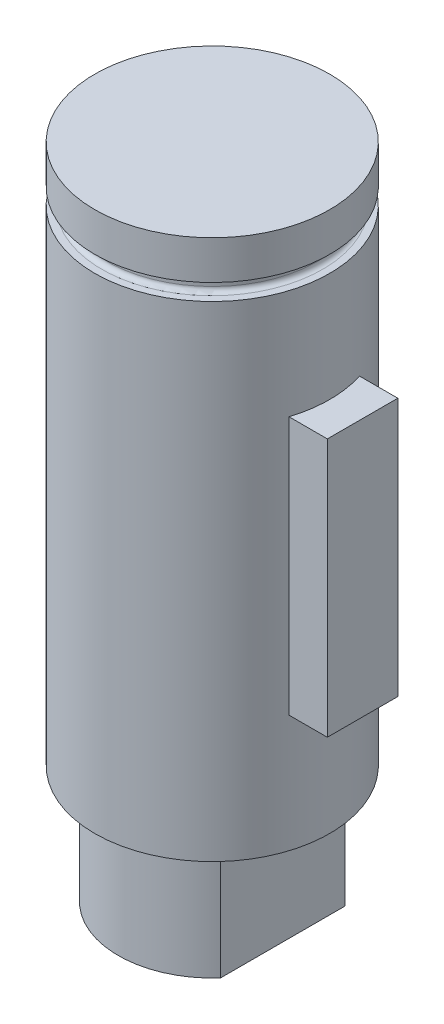
from build123d import *

# Parameters (mm, degrees)
BOSS_EXTRUDE1_DEPTH = 11
SKETCH2_R           = 5
BOSS_EXTRUDE2_DEPTH = 7
BOSS_EXTRUDE3_START = 5
SKETCH3_R           = 5
BOSS_EXTRUDE3_DEPTH = 5
SKETCH4_R           = 1.5
CUT_EXTRUDE1_DEPTH  = 5
BOSS_EXTRUDE4_START = 5
SKETCH5_R           = 1.5
BOSS_EXTRUDE4_DEPTH = 5


with BuildPart() as part:
    # Sketch1 → Boss-Extrude1 (new body)
    with BuildSketch(Plane(origin=(0, 0, 0), x_dir=(1, 0, 0), z_dir=(0, 1, 0))):
        with BuildLine():
            Line((6.4, -1.5), (6.4, 1.5))
            Line((6.4, 1.5), (4.769696007, 1.5))
            ThreePointArc((4.769696007, 1.5), (-5, 0), (4.769696007, -1.5))
            Line((4.769696007, -1.5), (6.4, -1.5))
        make_face()
    extrude(amount=BOSS_EXTRUDE1_DEPTH)

    # Sketch2 → Boss-Extrude2 (add)
    with BuildSketch(Plane(origin=(0, 11, 0), x_dir=(1, 0, 0), z_dir=(0, 1, 0))):
        with Locations(Location((0, 0, 0), (0, 0, 17.457603124))):
            Circle(SKETCH2_R)
    extrude(amount=BOSS_EXTRUDE2_DEPTH)

    # Sketch3 → Boss-Extrude3 (add)
    with BuildSketch(Plane.XZ.offset(BOSS_EXTRUDE3_START)):
        with Locations(Location((0, 0, 0), (0, 0, 270))):
            Circle(SKETCH3_R)
    extrude(amount=-BOSS_EXTRUDE3_DEPTH)

    # Sketch4 → Cut-Extrude1 (cut)
    with BuildSketch(Plane.XZ.offset(5)):
        with Locations(Location((0, 0, 0), (0, 0, 270))):
            Circle(SKETCH4_R)
    extrude(amount=-CUT_EXTRUDE1_DEPTH, mode=Mode.SUBTRACT)

    # Groove Sketch → Retaining Ring Groove (revolve, cut)
    with BuildSketch(Plane(origin=(2.625078192, 11.422429342, 0.508978061), x_dir=(-0.8829601883454016, 0.43711857808393034, -0.17119770585768931), z_dir=(-0.19034574864175483, 0, 0.9817171160645056)), mode=Mode.PRIVATE) as retaining_ring_groove_sk:
        with BuildLine():
            Line((8.786106351, -1.208578661), (10.022786693, -0.607540616))
            Line((10.022786693, -0.607540616), (9.716803689, 0.022042104))
            Line((9.716803689, 0.022042104), (8.480123346, -0.578995941))
            ThreePointArc((8.480123346, -0.578995941), (8.378534243, -0.693499703), (8.387666285, -0.846300434))
            Line((8.387666285, -0.846300434), (8.518801858, -1.116121599))
            ThreePointArc((8.518801858, -1.116121599), (8.63330562, -1.217710703), (8.786106351, -1.208578661))
        make_face()
    revolve(retaining_ring_groove_sk.sketch.rotate(Axis((0, 56.465370667, 0), (0, -1, 0)), 79.027037624), axis=Axis((0, 56.465370667, 0), (0, -1, 0)), mode=Mode.SUBTRACT)

    # Sketch5 → Boss-Extrude4 (add)
    with BuildSketch(Plane.XZ.offset(5).offset(BOSS_EXTRUDE4_START)):
        with BuildLine():
            Line((3, -2.645751311), (3, 2.645751311))
            ThreePointArc((3, 2.645751311), (-4, 0), (3, -2.645751311))
        make_face()
        with Locations(Location((0, 0, 0), (0, 0, 270))):
            Circle(SKETCH5_R, mode=Mode.SUBTRACT)
    extrude(amount=-BOSS_EXTRUDE4_DEPTH)


solid = part.part
